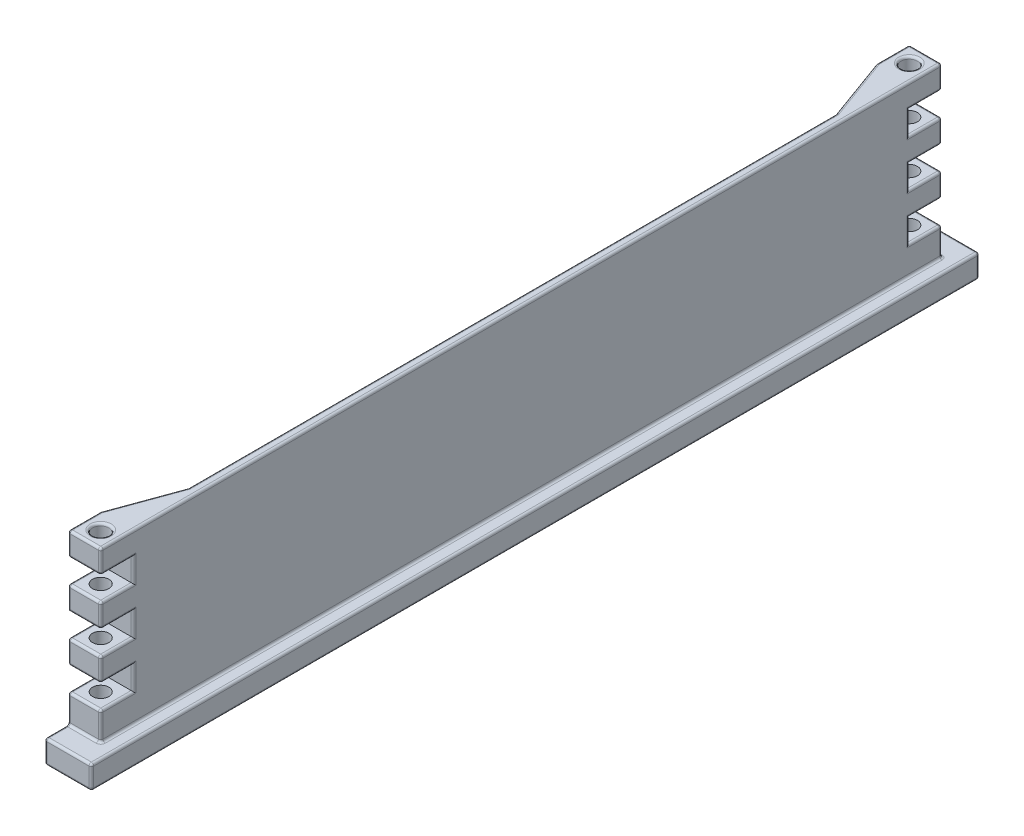
from build123d import *

# Parameters (mm, degrees)
BOSS_EXTRUDE1_DEPTH     = 7
CUT_EXTRUDE3_DEPTH      = 66.038450166
CUT_EXTRUDE3_DEPTH_BACK = 66.038450166
SKETCH7_R               = 1.75
SKETCH3_W               = 95
SKETCH3_H               = 5
BOSS_EXTRUDE2_DEPTH     = 3
CUT_EXTRUDE4_DEPTH      = 66.429351212
CUT_EXTRUDE4_DEPTH_BACK = 8
SKETCH7_3_R             = 1.75
CUT_EXTRUDE5_DEPTH      = 39
FILLET1_R               = 0.5


with BuildPart() as part:
    # Sketch1 → Boss-Extrude1 (new body)
    with BuildSketch(Plane(origin=(0, 0, 0), x_dir=(0, 0, -1), z_dir=(1, 0, 0))):
        Polygon((-50, -20.5), (-45, -20.5), (45, -20.5), (45, 20.5), (-38, 20.5), (-45, 20.5), (-45, 15.5), (-38, 15.5), (-38, 10.5), (-45, 10.5), (-45, 5.5), (-38, 5.5), (-38, 0.5), (-45, 0.5), (-45, -4.5), (-38, -4.5), (-38, -9.5), (-45, -9.5), (-45, -15.5), (-50, -15.5), align=None)
    extrude(amount=BOSS_EXTRUDE1_DEPTH)

    # Sketch7 → Cut-Extrude3 (cut, two sides: drawn at the far end of the back side and taken through both)
    with BuildSketch(Plane.XZ.offset(20.5).offset(-CUT_EXTRUDE3_DEPTH_BACK)):
        with Locations((3.5, 41.5)):
            Circle(SKETCH7_R)
    extrude(amount=CUT_EXTRUDE3_DEPTH + CUT_EXTRUDE3_DEPTH_BACK, mode=Mode.SUBTRACT)

    # Sketch3 → Boss-Extrude2 (add)
    with BuildSketch(Plane(origin=(7, 0, 0), x_dir=(0, 0, -1), z_dir=(1, 0, 0))):
        with Locations((-2.5, -18)):
            Rectangle(SKETCH3_W, SKETCH3_H)
    extrude(amount=BOSS_EXTRUDE2_DEPTH)

    # Sketch7<3> → Cut-Extrude4 (cut, two sides: drawn at the far end of the back side and taken through both)
    with BuildSketch(Plane.XZ.offset(20.5).offset(-CUT_EXTRUDE4_DEPTH_BACK)):
        Polygon((0.671258352, 43.12451655), (0.678756575, 39.862496147), (3.507498223, 38.237979597), (6.328741648, 39.87548345), (6.321243425, 43.137503853), (3.492501777, 44.762020403), align=None)
        with Locations((3.5, 41.5)):
            Circle(SKETCH7_3_R, mode=Mode.SUBTRACT)
    extrude(amount=CUT_EXTRUDE4_DEPTH + CUT_EXTRUDE4_DEPTH_BACK, mode=Mode.SUBTRACT)

    # Sketch8 → Cut-Extrude5 (cut)
    with BuildSketch(Plane(origin=(0, 20.5, 0), x_dir=(1, 0, 0), z_dir=(0, 1, 0))):
        Polygon((0, -38), (5, -24.262612903), (5, 45), (0, 45), align=None)
    extrude(amount=-CUT_EXTRUDE5_DEPTH, mode=Mode.SUBTRACT)

    # Mirror2: part across plane


with BuildPart() as part_1:
    add(part.part)
    add(part.part.mirror(Plane(origin=(7, 0, -45), x_dir=(1, 0, 0), z_dir=(0, 0, 1))))

    # Fillet1
    fillet1_edges = [part_1.edges().sort_by_distance(p)[0] for p in [
        (3.5, -9.5, 45),
        (3.5, -15.5, 45),
        (0, -12.5, 45),
        (5, -15.5, 50),
        (5, -20.5, 50),
        (0, -18, 50),
        (5, -20.5, -140),
        (5, -15.5, -140),
        (0, -18, -140),
        (3.5, -15.5, -135),
        (3.5, -9.5, -135),
        (0, -12.5, -135),
        (3.5, -4.5, -135),
        (3.5, 0.5, -135),
        (0, -2, -135),
        (3.5, 5.5, -135),
        (3.5, 10.5, -135),
        (0, 8, -135),
        (3.5, 15.5, -135),
        (0, 18, -135),
        (3.5, 15.5, 45),
        (0, 18, 45),
        (3.5, 10.5, 45),
        (3.5, 5.5, 45),
        (0, 8, 45),
        (3.5, 0.5, 45),
        (3.5, -4.5, 45),
        (0, -2, 45),
        (5, 1, 24.262612903),
        (5, 1, -114.262612903),
        (7, -9.5, 41.5),
        (7, -7, 38),
        (7, -4.5, 41.5),
        (7, -2, 45),
        (7, 0.5, 41.5),
        (7, 3, 38),
        (7, 5.5, 41.5),
        (7, 8, 45),
        (7, 10.5, 41.5),
        (7, 13, 38),
        (7, 15.5, 41.5),
        (7, 18, 45),
        (7, 18, -135),
        (7, 15.5, -131.5),
        (7, 13, -128),
        (7, 10.5, -131.5),
        (7, 8, -135),
        (7, 5.5, -131.5),
        (7, 3, -128),
        (7, 0.5, -131.5),
        (7, -2, -135),
        (7, -4.5, -131.5),
        (7, -7, -128),
        (7, -9.5, -131.5),
        (7, -12.5, -135),
        (7, -15.5, -45),
        (7, -12.5, 45),
        (1.75, 20.5, -131.5),
        (1.75, 20.5, 41.5),
        (5, 20.5, -45),
        (2.5, 20.5, -121.131306451),
        (0, 20.5, -131.5),
        (3.5, 20.5, -135),
        (7, 20.5, -45),
        (3.5, 20.5, 45),
        (0, 20.5, 41.5),
        (2.5, 20.5, 31.131306451),
        (0, -4.5, 41.5),
        (0, 0.5, 41.5),
        (0, 10.5, 41.5),
        (0, 15.5, 41.5),
        (0, -9.5, 41.5),
        (0, -15.5, 47.5),
        (0, 15.5, -131.5),
        (0, 10.5, -131.5),
        (0, 5.5, -131.5),
        (0, -4.5, -131.5),
        (0, 0.5, -131.5),
        (0, -9.5, -131.5),
        (0, -15.5, -137.5),
        (0, -20.5, -45),
        (5, -18.5, -45),
        (0, -18.5, -45),
        (10, -18, 50),
        (10, -18, -140),
        (10, -20.5, -45),
        (10, -15.5, -45),
    ]]
    fillet(fillet1_edges, radius=FILLET1_R)


solid = part_1.part
